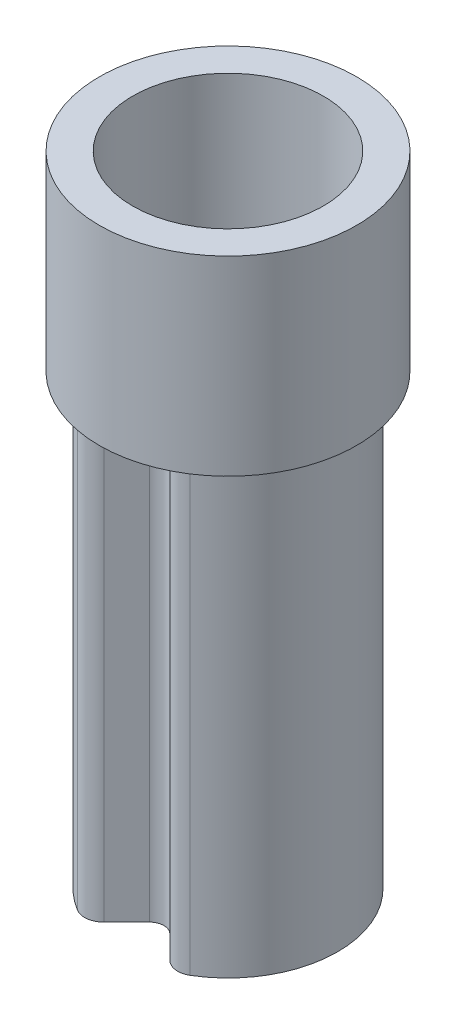
from build123d import *

# Parameters (mm, degrees)
BOSS_EXTRUDE1_DEPTH = 4.7
FILLET1_R           = 0.05
FILLET2_R           = 0.2
SKETCH2_R           = 1.35
SKETCH2_R_2         = 1
BOSS_EXTRUDE2_DEPTH = 2


with BuildPart() as part:
    # Sketch1 → Boss-Extrude1 (new body)
    with BuildSketch(Plane(origin=(0, 0, 0), x_dir=(1, 0, 0), z_dir=(0, 1, 0))):
        with BuildLine():
            Line((-0.448807004, -1.058807004), (-0.106066017, -0.716066017))
            ThreePointArc((-0.106066017, -0.716066017), (0, -0.672132034), (0.106066017, -0.716066017))
            Line((0.106066017, -0.716066017), (0.448807004, -1.058807004))
            ThreePointArc((0.448807004, -1.058807004), (0, 1.15), (-0.448807004, -1.058807004))
        make_face()
        with BuildLine():
            Line((-0.479612457, -0.877480422), (-0.212132034, -0.61))
            ThreePointArc((-0.212132034, -0.61), (0, -0.522132034), (0.212132034, -0.61))
            Line((0.212132034, -0.61), (0.479612457, -0.877480422))
            ThreePointArc((0.479612457, -0.877480422), (0, 1), (-0.479612457, -0.877480422))
        make_face(mode=Mode.SUBTRACT)
    extrude(amount=BOSS_EXTRUDE1_DEPTH)

    # Fillet1
    fillet1_edges = [part.edges().sort_by_distance(p)[0] for p in [
        (0.479612457, 2.35, 0.877480422),
        (-0.479612457, 2.35, 0.877480422),
    ]]
    fillet(fillet1_edges, radius=FILLET1_R)

    # Fillet2
    fillet2_edges = [part.edges().sort_by_distance(p)[0] for p in [
        (-0.448807004, 2.35, 1.058807004),
        (0.448807004, 2.35, 1.058807004),
    ]]
    fillet(fillet2_edges, radius=FILLET2_R)

    # Sketch2 → Boss-Extrude2 (add)
    with BuildSketch(Plane(origin=(0, 4.7, 0), x_dir=(1, 0, 0), z_dir=(0, 1, 0))):
        with Locations(Location((0, 0, 0), (0, 0, 270))):
            Circle(SKETCH2_R)
        with Locations(Location((0, 0, 0), (0, 0, 239.09383603))):
            Circle(SKETCH2_R_2, mode=Mode.SUBTRACT)
    extrude(amount=BOSS_EXTRUDE2_DEPTH)


solid = part.part
